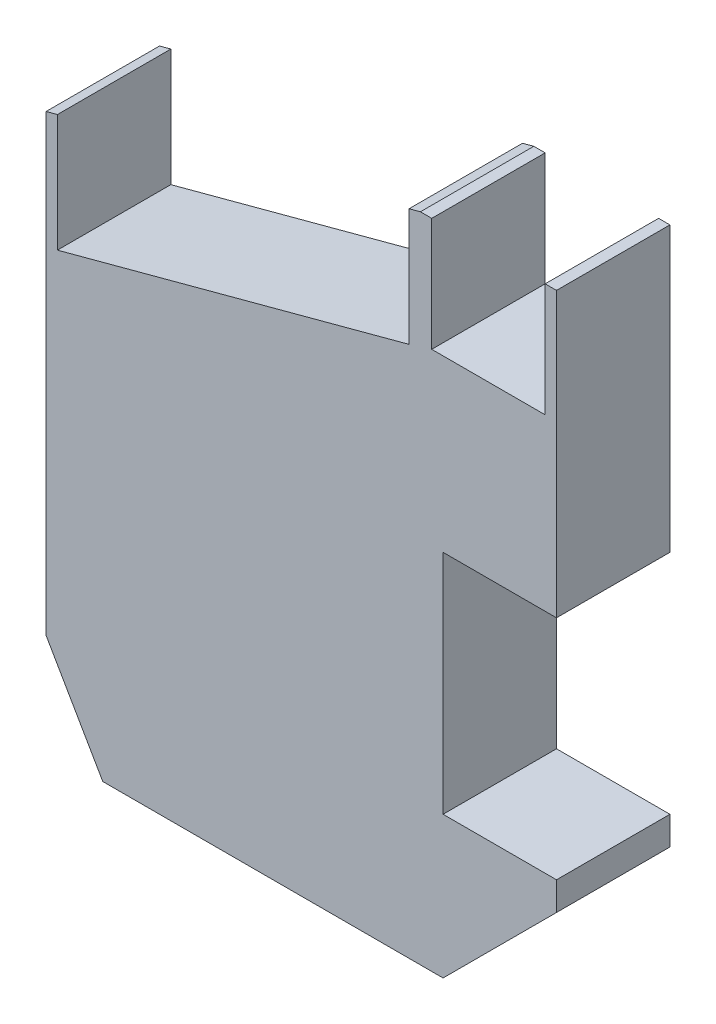
from build123d import *

# Parameters (mm, degrees)
BOSS_EXTRUDE1_DEPTH     = 20
CUT_EXTRUDE1_DEPTH      = 142.509716981
CUT_EXTRUDE1_DEPTH_BACK = 20
SKETCH2_W               = 20
SKETCH2_H               = 20
SKETCH2_H_2             = 40


with BuildPart() as part:
    # Sketch1 → Boss-Extrude1 (new body)
    with BuildSketch(Plane.XY):
        Polygon((0, 0), (60, 0), (80, 20), (80, 115), (56, 115), (-10, 97.3153533), (-10, 17.3153533), align=None)
    extrude(amount=BOSS_EXTRUDE1_DEPTH)

    # Sketch2 → Cut-Extrude1 (cut, two sides: drawn at the far end of the back side and taken through both)
    with BuildSketch(Plane.XY.offset(20).offset(-CUT_EXTRUDE1_DEPTH_BACK)):
        with Locations((68, 105)):
            Rectangle(SKETCH2_W, SKETCH2_H)
        Polygon((54, 93.758578007), (54, 114.464101615), (-8, 97.851251684), (-8, 77.145728076), align=None)
        with Locations((70, 45)):
            Rectangle(SKETCH2_W, SKETCH2_H_2)
    extrude(amount=CUT_EXTRUDE1_DEPTH + CUT_EXTRUDE1_DEPTH_BACK, mode=Mode.SUBTRACT)


solid = part.part
